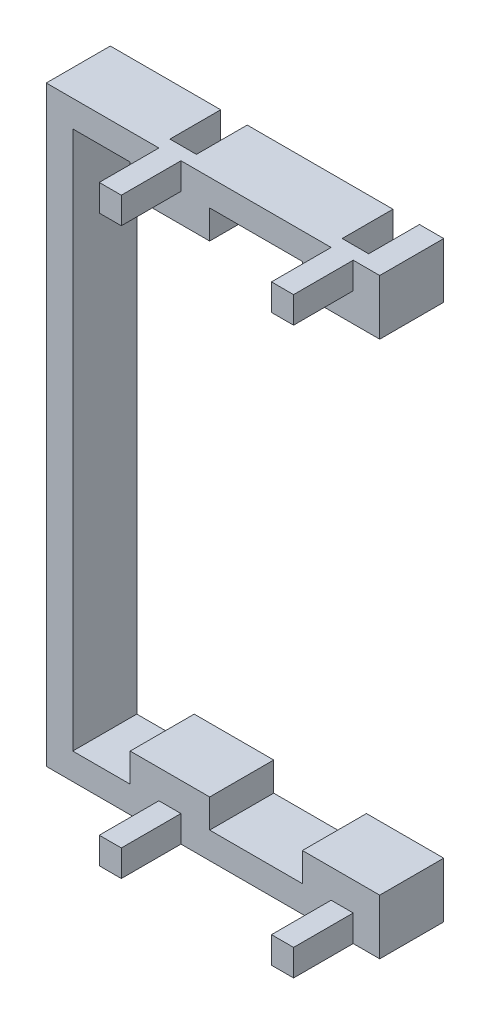
from build123d import *

# Parameters (mm, degrees)
BOSS_EXTRUDE1_DEPTH   = 7.25
SKETCH2_W             = 2.5
SKETCH2_H             = 3
BOSS_EXTRUDE2_DEPTH   = 8.25
BOSS_EXTRUDE2_2_DEPTH = 8.25
BOSS_EXTRUDE2_3_DEPTH = 8.25
BOSS_EXTRUDE2_4_DEPTH = 8.25
SKETCH3_W             = 3
SKETCH3_H             = 3.25
BOSS_EXTRUDE3_DEPTH   = 1.5


with BuildPart() as part:
    # Sketch1 → Boss-Extrude1 (new body)
    with BuildSketch(Plane.XY):
        Polygon((-4.25, 58.75), (8.25, 58.75), (8.25, 55.5), (11.25, 55.5), (11.25, 58.75), (27.75, 58.75), (27.75, 55.5), (30.75, 55.5), (30.75, 58.75), (33.5, 58.75), (33.5, 52.5), (24.75, 52.5), (24.75, 55.75), (14.25, 55.75), (14.25, 52.5), (5.25, 52.5), (5.25, 55.75), (-1.25, 55.75), (-1.25, -5.25), (5.25, -5.25), (5.25, -2), (14.25, -2), (14.25, -5.25), (24.75, -5.25), (24.75, -2), (33.5, -2), (33.5, -8.25), (30.75, -8.25), (30.75, -5), (27.75, -5), (27.75, -8.25), (11.25, -8.25), (11.25, -5), (8.25, -5), (8.25, -8.25), (-4.25, -8.25), align=None)
    extrude(amount=BOSS_EXTRUDE1_DEPTH)



with BuildPart() as body_2:
    # Sketch2 → Boss-Extrude2 (new body)
    with BuildSketch(Plane.XY.offset(5.75)):
        with Locations((9.75, -6.75)):
            Rectangle(SKETCH2_W, SKETCH2_H)
    extrude(amount=BOSS_EXTRUDE2_DEPTH)


with BuildPart() as body_3:
    # Sketch2 → Boss-Extrude2 2 (new body)
    with BuildSketch(Plane.XY.offset(5.75)):
        with Locations((29.25, -6.75)):
            Rectangle(SKETCH2_W, SKETCH2_H)
    extrude(amount=BOSS_EXTRUDE2_2_DEPTH)


with BuildPart() as body_4:
    # Sketch2 → Boss-Extrude2 3 (new body)
    with BuildSketch(Plane.XY.offset(5.75)):
        with Locations((29.25, 57.25)):
            Rectangle(SKETCH2_W, SKETCH2_H)
    extrude(amount=BOSS_EXTRUDE2_3_DEPTH)


with BuildPart() as body_5:
    # Sketch2 → Boss-Extrude2 4 (new body)
    with BuildSketch(Plane.XY.offset(5.75)):
        with Locations((9.75, 57.25)):
            Rectangle(SKETCH2_W, SKETCH2_H)
    extrude(amount=BOSS_EXTRUDE2_4_DEPTH)


with BuildPart() as part_1:
    add(part.part)

    add(body_2.part)  # Boss-Extrude3 merges body 2

    add(body_3.part)  # Boss-Extrude3 merges body 3

    add(body_4.part)  # Boss-Extrude3 merges body 4

    add(body_5.part)  # Boss-Extrude3 merges body 5
    # Sketch3 → Boss-Extrude3 (add)
    with BuildSketch(Plane(origin=(0, 0, 5.75), x_dir=(-1, 0, 0), z_dir=(0, 0, -1))):
        with Locations((-9.75, 57.125)):
            Rectangle(SKETCH3_W, SKETCH3_H)
        with Locations((-29.25, 57.125)):
            Rectangle(SKETCH3_W, SKETCH3_H)
        with Locations((-29.25, -6.625)):
            Rectangle(SKETCH3_W, SKETCH3_H)
        with Locations((-9.75, -6.625)):
            Rectangle(SKETCH3_W, SKETCH3_H)
    extrude(amount=-BOSS_EXTRUDE3_DEPTH)


solid = part_1.part
